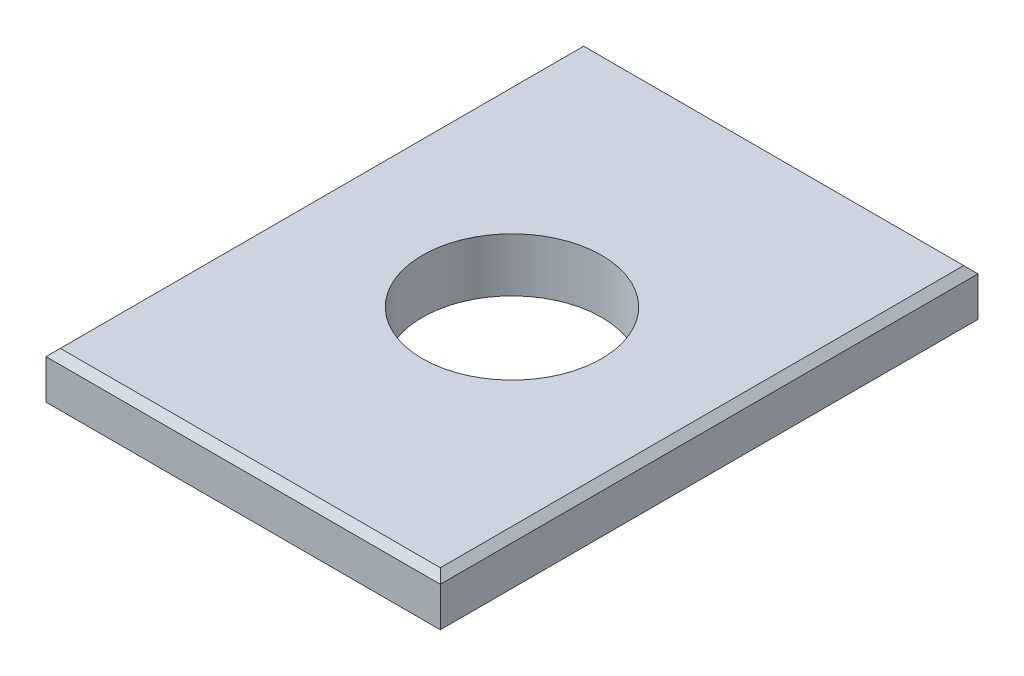
from build123d import *

# Parameters (mm, degrees)
SKETCH_1_W          = 11
SKETCH_1_H          = 15
EXTRUDE_1_DEPTH     = 1.5
SKETCH_2_R          = 2.5
CUT_EXTRUDE_1_DEPTH = 1.5
CHAMFER_1_SIZE      = 0.2
CHAMFER_2_SIZE      = 0.2


with BuildPart() as part:
    # ｽｹｯﾁ1 → ﾎﾞｽ - 押し出し1 (new body)
    with BuildSketch(Plane(origin=(0, 0, 0), x_dir=(1, 0, 0), z_dir=(0, 1, 0))):
        Rectangle(SKETCH_1_W, SKETCH_1_H)
    extrude(amount=EXTRUDE_1_DEPTH)

    # ｽｹｯﾁ2 → ｶｯﾄ - 押し出し1 (cut)
    with BuildSketch(Plane(origin=(0, 1.5, 0), x_dir=(1, 0, 0), z_dir=(0, 1, 0))):
        with Locations(Location((0, 0, 0), (0, 0, 270))):
            Circle(SKETCH_2_R)
    extrude(amount=-CUT_EXTRUDE_1_DEPTH, mode=Mode.SUBTRACT)

    # 面取り1
    chamfer_1_edges = [part.edges().sort_by_distance(p)[0] for p in [
        (-5.5, 1.5, 0),
        (0, 1.5, 7.5),
        (5.5, 1.5, 0),
        (0, 1.5, -7.5),
    ]]
    chamfer(chamfer_1_edges, length=CHAMFER_1_SIZE)

    # 面取り2
    chamfer_2_edges = [part.edges().sort_by_distance(p)[0] for p in [
        (0, 0, 7.5),
        (-5.5, 0, 0),
        (0, 0, -7.5),
        (5.5, 0, 0),
    ]]
    chamfer(chamfer_2_edges, length=CHAMFER_2_SIZE)


solid = part.part
